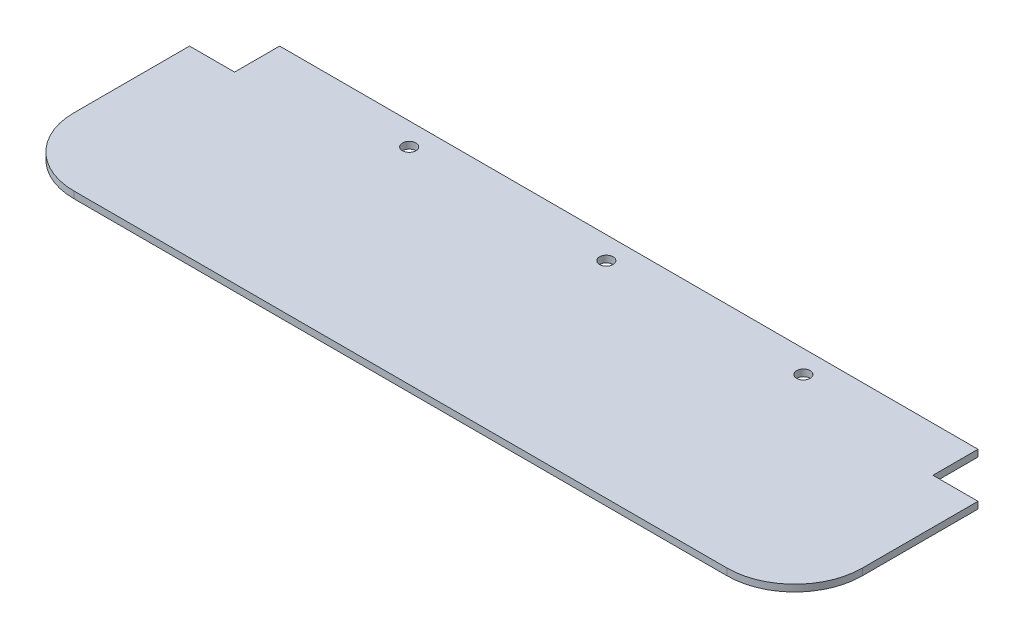
from build123d import *

# Parameters (mm, degrees)
SKETCH_1_W          = 350
SKETCH_1_H          = 101.37
EXTRUDE_1_DEPTH     = 3
SKETCH_2_R          = 3
SKETCH_2_W          = 20
SKETCH_2_H          = 20
CUT_EXTRUDE_1_DEPTH = 183.21681927
FILLET_1_R          = 30


with BuildPart() as part:
    # 草圖1 → 填料-伸長1 (new body)
    with BuildSketch(Plane(origin=(0, 0, 0), x_dir=(1, 0, 0), z_dir=(0, 1, 0))):
        Rectangle(SKETCH_1_W, SKETCH_1_H)
    extrude(amount=EXTRUDE_1_DEPTH)

    # 草圖2 → 除料-伸長1 (cut, through all)
    with BuildSketch(Plane(origin=(0, 3, 0), x_dir=(1, 0, 0), z_dir=(0, 1, 0))):
        with Locations(Location((-87.5, 40.685, 0), (0, 0, 270))):
            Circle(SKETCH_2_R)
        with Locations(Location((0, 40.685, 0), (0, 0, 270))):
            Circle(SKETCH_2_R)
        with Locations(Location((87.5, 40.685, 0), (0, 0, 270))):
            Circle(SKETCH_2_R)
        with Locations((-165, 40.685)):
            Rectangle(SKETCH_2_W, SKETCH_2_H)
        with Locations((165, 40.685)):
            Rectangle(SKETCH_2_W, SKETCH_2_H)
    extrude(amount=-CUT_EXTRUDE_1_DEPTH, mode=Mode.SUBTRACT)

    # 圓角1
    fillet_1_edges = [part.edges().sort_by_distance(p)[0] for p in [
        (175, 1.5, 50.685),
        (-175, 1.5, 50.685),
    ]]
    fillet(fillet_1_edges, radius=FILLET_1_R)


solid = part.part
